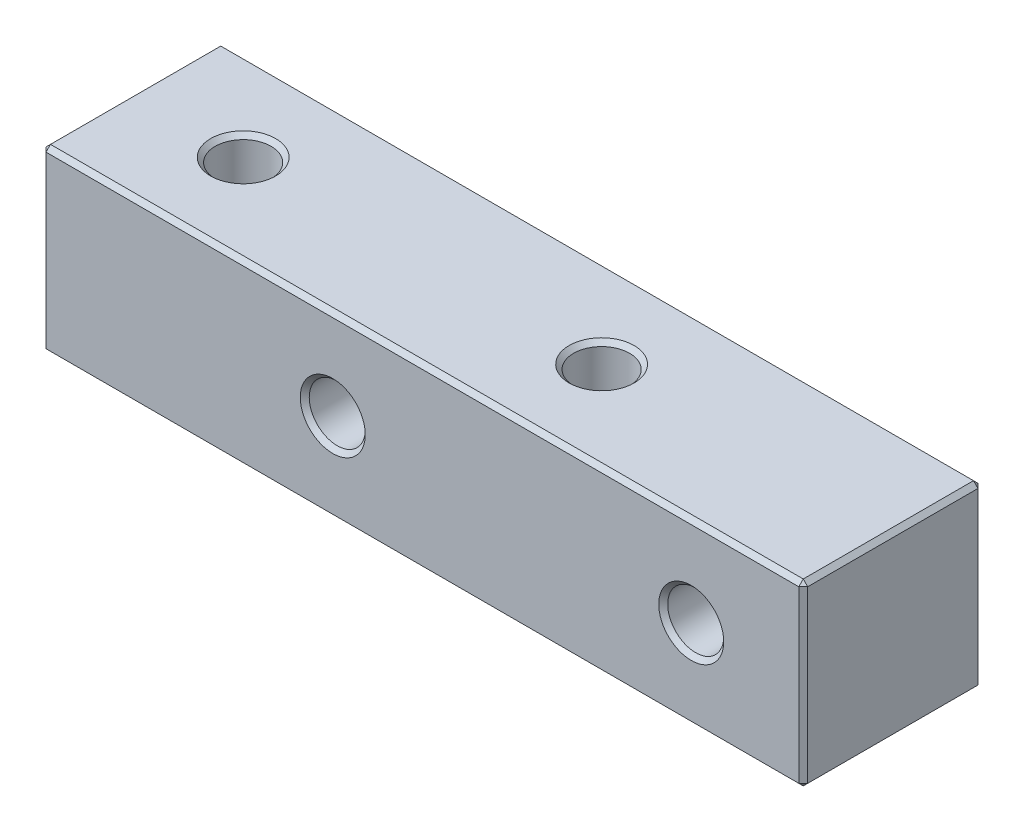
from build123d import *

# Parameters (mm, degrees)
SKETCH_1_W         = 34
SKETCH_1_H         = 8
EXTRUDE_1_DEPTH    = 4
HOLE_WIZARD_M3_1_D = 2.5
HOLE_WIZARD_M3_2_D = 2.5
CHAMFER_1_SIZE     = 0.2


with BuildPart() as part:
    # 草图1 → 凸台-拉伸1 (new, symmetric)
    with BuildSketch(Plane(origin=(0, 0, 0), x_dir=(1, 0, 0), z_dir=(0, 1, 0))):
        Rectangle(SKETCH_1_W, SKETCH_1_H)
    extrude(amount=EXTRUDE_1_DEPTH, both=True)

    # M3 螺纹孔1 (through all)
    with Locations(Plane(origin=(0, 4, 0), x_dir=(1, 0, 0), z_dir=(0, 1, 0))):
        with Locations((-12, 0), (4, 0)):
            Hole(HOLE_WIZARD_M3_1_D / 2)

    # M3 螺纹孔2 (through all)
    with Locations(Plane(origin=(0, 0, -4), x_dir=(-1, 0, 0), z_dir=(0, 0, -1))):
        with Locations((-12, 0), (4, 0)):
            Hole(HOLE_WIZARD_M3_2_D / 2)

    # 倒角1
    chamfer_1_edges = [part.edges().sort_by_distance(p)[0] for p in [
        (-17, 4, 0),
        (5.25, 4, 0),
        (5.25, -4, 0),
        (0, 4, 4),
        (-10.75, 4, 0),
        (-10.75, -4, 0),
        (-5.25, 0, -4),
        (-5.25, 0, 4),
        (10.75, 0, -4),
        (10.75, 0, 4),
        (17, 4, 0),
        (0, -4, 4),
        (-17, -4, 0),
        (0, -4, -4),
        (17, -4, 0),
        (17, 0, 4),
        (-17, 0, 4),
        (-17, 0, -4),
        (17, 0, -4),
        (0, 4, -4),
    ]]
    chamfer(chamfer_1_edges, length=CHAMFER_1_SIZE)


solid = part.part
